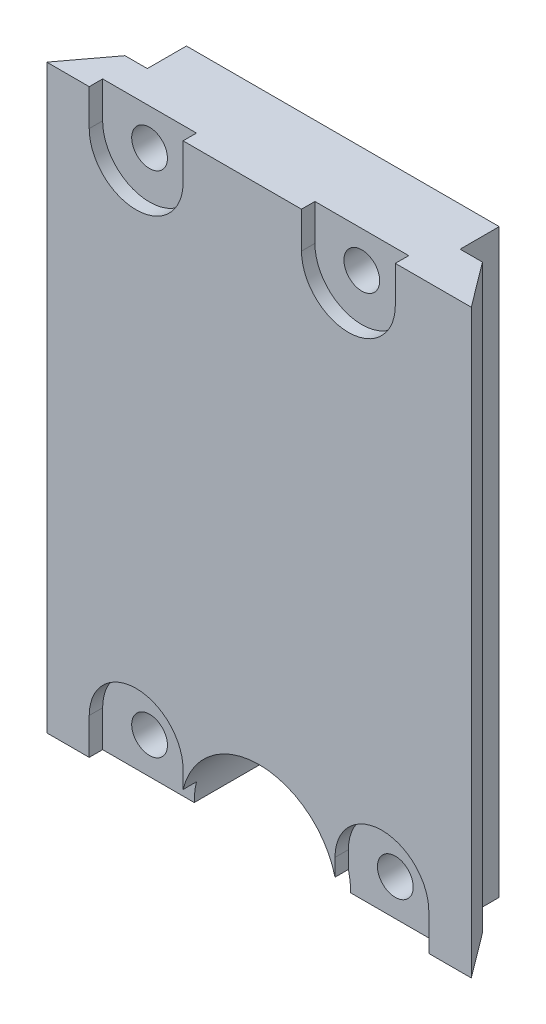
from build123d import *

# Parameters (mm, degrees)
EXTRUDE_1_DEPTH     = 52
SKETCH_3_W          = 28
SKETCH_3_H          = 52
EXTRUDE_2_DEPTH     = 3.5
CUT_EXTRUDE_1_REACH = 66.84
SKETCH_4_R          = 1.6
SKETCH_6_R          = 7
CUT_EXTRUDE_2_DEPTH = 65.840188155
SKETCH_7_R          = 4
CUT_EXTRUDE_3_DEPTH = 1.2
CUT_EXTRUDE_4_REACH = 66.712


with BuildPart() as part:
    # 草图2 → 凸台-拉伸1 (new body)
    with BuildSketch(Plane(origin=(0, 0, 0), x_dir=(1, 0, 0), z_dir=(0, 1, 0))):
        Polygon((0, 0), (38, 0), (35, 4), (3, 4), align=None)
    extrude(amount=EXTRUDE_1_DEPTH)

    # 草图3 → 凸台-拉伸2 (add)
    with BuildSketch(Plane(origin=(0, 0, -4), x_dir=(-1, 0, 0), z_dir=(0, 0, -1))):
        with Locations((-19, 26)):
            Rectangle(SKETCH_3_W, SKETCH_3_H)
    extrude(amount=EXTRUDE_2_DEPTH)

    # 草图4 → 切除-拉伸1 (cut, up to next)
    with BuildSketch(Plane.XY, mode=Mode.PRIVATE) as cut_extrude_1_sk1:
        with Locations((8, 3.25)):
            Circle(SKETCH_4_R)
    cut_extrude_1_tool1 = extrude(cut_extrude_1_sk1.sketch, amount=-CUT_EXTRUDE_1_REACH, mode=Mode.PRIVATE) & part.part
    # 草图4 → 切除-拉伸1 (cut, up to next)
    with BuildSketch(Plane.XY, mode=Mode.PRIVATE) as cut_extrude_1_sk2:
        with Locations((30, 3.25)):
            Circle(SKETCH_4_R)
    cut_extrude_1_tool2 = extrude(cut_extrude_1_sk2.sketch, amount=-CUT_EXTRUDE_1_REACH, mode=Mode.PRIVATE) & part.part
    # 草图4 → 切除-拉伸1 (cut, up to next)
    with BuildSketch(Plane.XY, mode=Mode.PRIVATE) as cut_extrude_1_sk3:
        with Locations((8, 48.75)):
            Circle(SKETCH_4_R)
    cut_extrude_1_tool3 = extrude(cut_extrude_1_sk3.sketch, amount=-CUT_EXTRUDE_1_REACH, mode=Mode.PRIVATE) & part.part
    # 草图4 → 切除-拉伸1 (cut, up to next)
    with BuildSketch(Plane.XY, mode=Mode.PRIVATE) as cut_extrude_1_sk4:
        with Locations((27, 48.75)):
            Circle(SKETCH_4_R)
    cut_extrude_1_tool4 = extrude(cut_extrude_1_sk4.sketch, amount=-CUT_EXTRUDE_1_REACH, mode=Mode.PRIVATE) & part.part
    add(cut_extrude_1_tool1.solids().sort_by_distance((8, 3.25, 0))[0], mode=Mode.SUBTRACT)
    add(cut_extrude_1_tool2.solids().sort_by_distance((30, 3.25, 0))[0], mode=Mode.SUBTRACT)
    add(cut_extrude_1_tool3.solids().sort_by_distance((8, 48.75, 0))[0], mode=Mode.SUBTRACT)
    add(cut_extrude_1_tool4.solids().sort_by_distance((27, 48.75, 0))[0], mode=Mode.SUBTRACT)

    # 草图6 → 切除-拉伸2 (cut, through all)
    with BuildSketch(Plane.XY):
        with Locations((19, 0.05)):
            Circle(SKETCH_6_R)
    extrude(amount=-CUT_EXTRUDE_2_DEPTH, mode=Mode.SUBTRACT)

    # 草图7 → 切除-拉伸3 (cut)
    with BuildSketch(Plane.XY):
        with Locations((8, 48.75)):
            Circle(SKETCH_7_R)
        with Locations((27, 48.75)):
            Circle(SKETCH_7_R)
        with Locations((8, 3.25)):
            Circle(SKETCH_7_R)
        with Locations((30, 3.25)):
            Circle(SKETCH_7_R)
    extrude(amount=-CUT_EXTRUDE_3_DEPTH, mode=Mode.SUBTRACT)

    # 草图8 → 切除-拉伸4 (cut, up to next)
    with BuildSketch(Plane.XY.offset(-1.2), mode=Mode.PRIVATE) as cut_extrude_4_sk1:
        with BuildLine():
            Line((3.8, 48.75), (3.8, 52))
            ThreePointArc((3.8, 52), (8, 56.2), (12.2, 52))
            Line((12.2, 52), (12.2, 48.75))
            ThreePointArc((12.2, 48.75), (8, 44.55), (3.8, 48.75))
        make_face()
    cut_extrude_4_tool1 = extrude(cut_extrude_4_sk1.sketch, amount=CUT_EXTRUDE_4_REACH, mode=Mode.PRIVATE) & part.part
    # 草图8 → 切除-拉伸4 (cut, up to next)
    with BuildSketch(Plane.XY.offset(-1.2), mode=Mode.PRIVATE) as cut_extrude_4_sk2:
        with BuildLine():
            Line((22.8, 48.75), (22.8, 52))
            ThreePointArc((22.8, 52), (27, 56.2), (31.2, 52))
            Line((31.2, 52), (31.2, 48.75))
            ThreePointArc((31.2, 48.75), (27, 44.55), (22.8, 48.75))
        make_face()
    cut_extrude_4_tool2 = extrude(cut_extrude_4_sk2.sketch, amount=CUT_EXTRUDE_4_REACH, mode=Mode.PRIVATE) & part.part
    # 草图8 → 切除-拉伸4 (cut, up to next)
    with BuildSketch(Plane.XY.offset(-1.2), mode=Mode.PRIVATE) as cut_extrude_4_sk3:
        with BuildLine():
            Line((12.2, 3.25), (12.2, 0))
            ThreePointArc((12.2, 0), (8, -4.2), (3.8, 0))
            Line((3.8, 0), (3.8, 3.25))
            ThreePointArc((3.8, 3.25), (8, 7.45), (12.2, 3.25))
        make_face()
    cut_extrude_4_tool3 = extrude(cut_extrude_4_sk3.sketch, amount=CUT_EXTRUDE_4_REACH, mode=Mode.PRIVATE) & part.part
    # 草图8 → 切除-拉伸4 (cut, up to next)
    with BuildSketch(Plane.XY.offset(-1.2), mode=Mode.PRIVATE) as cut_extrude_4_sk4:
        with BuildLine():
            Line((34.2, 3.25), (34.2, 0))
            ThreePointArc((34.2, 0), (30, -4.2), (25.8, 0))
            Line((25.8, 0), (25.8, 3.25))
            ThreePointArc((25.8, 3.25), (30, 7.45), (34.2, 3.25))
        make_face()
    cut_extrude_4_tool4 = extrude(cut_extrude_4_sk4.sketch, amount=CUT_EXTRUDE_4_REACH, mode=Mode.PRIVATE) & part.part
    add(cut_extrude_4_tool1.solids().sort_by_distance((8, 50.375, -1.2))[0], mode=Mode.SUBTRACT)
    add(cut_extrude_4_tool2.solids().sort_by_distance((27, 50.375, -1.2))[0], mode=Mode.SUBTRACT)
    add(cut_extrude_4_tool3.solids().sort_by_distance((8, 1.625, -1.2))[0], mode=Mode.SUBTRACT)
    add(cut_extrude_4_tool4.solids().sort_by_distance((30, 1.625, -1.2))[0], mode=Mode.SUBTRACT)


solid = part.part
